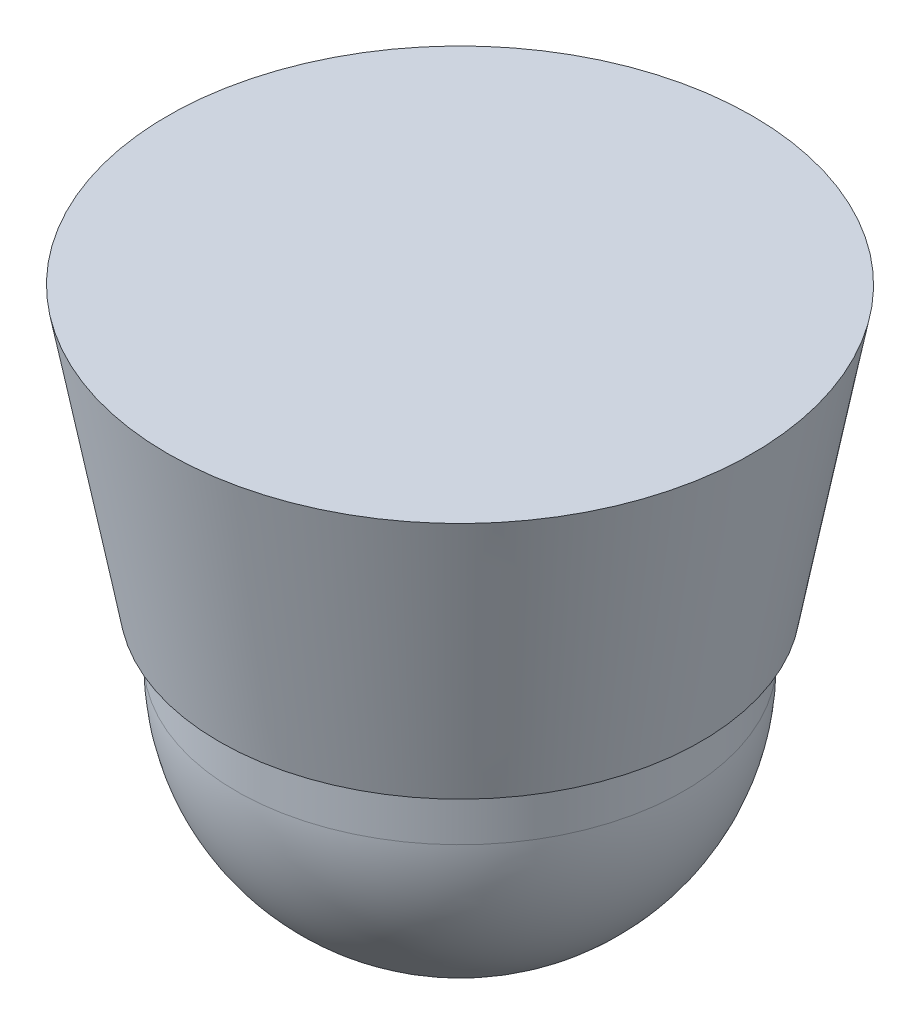
from build123d import *


with BuildPart() as part:
    # Croquis2 → Revolución1 (revolve)
    with BuildSketch(Plane.XY, mode=Mode.PRIVATE) as revoluci_n1_sk:
        Polygon((0, 0), (85, 0), (70, -80), (0, -80), align=None)
    revolve(revoluci_n1_sk.sketch.rotate(Axis((0, 241.818452045, 0), (0, -1, 0)), 90), axis=Axis((0, 241.818452045, 0), (0, -1, 0)))

    # Croquis3 → Revolución2 (revolve)
    with BuildSketch(Plane.XY):
        with BuildLine():
            Line((0, -159.84629585), (0, -80))
            Line((0, -80), (-65, -80))
            Line((-65, -80), (-65, -95))
            ThreePointArc((-65, -95), (-45.952595917, -140.907630317), (0, -159.84629585))
        make_face()
    revolve(axis=Axis((0, 159.591992211, 0), (0, -1, 0)))


solid = part.part
